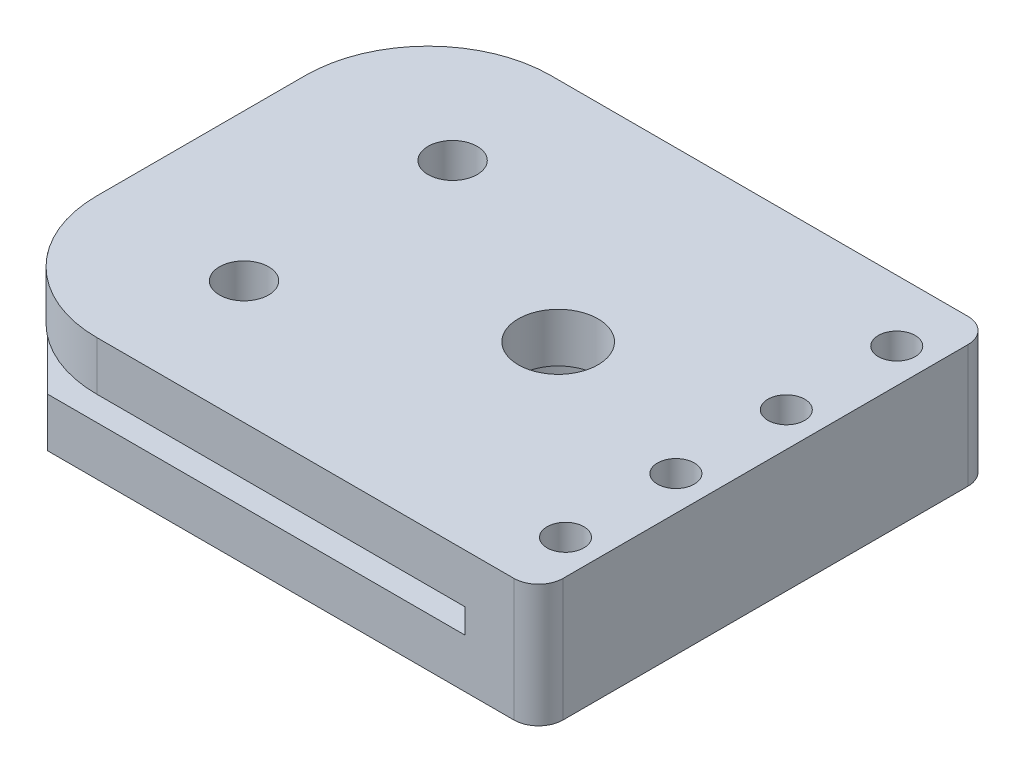
from build123d import *

# Parameters (mm, degrees)
SKETCH1_W           = 50
SKETCH1_H           = 37
BOSS_EXTRUDE1_DEPTH = 4
CHAMFER1_SIZE       = 10
SKETCH2_W           = 6
SKETCH2_H           = 37
BOSS_EXTRUDE2_DEPTH = 6
SKETCH3_W           = 37
SKETCH3_H           = 4
BOSS_EXTRUDE3_DEPTH = 40
FILLET1_R           = 10
SKETCH4_R           = 2
CUT_EXTRUDE1_DEPTH  = 40
SKETCH5_R           = 3.25
CUT_EXTRUDE2_DEPTH  = 40
SKETCH6_R           = 7.5
CUT_EXTRUDE3_DEPTH  = 5
SKETCH7_R           = 1.5
CUT_EXTRUDE4_DEPTH  = 9
FILLET2_R           = 2


with BuildPart() as part:
    # Sketch1 → Boss-Extrude1 (new body)
    with BuildSketch(Plane(origin=(0, 0, 0), x_dir=(1, 0, 0), z_dir=(0, 1, 0))):
        Rectangle(SKETCH1_W, SKETCH1_H)
    extrude(amount=BOSS_EXTRUDE1_DEPTH)

    # Chamfer1
    chamfer1_edges = [part.edges().sort_by_distance(p)[0] for p in [
        (-25, 2, 18.5),
        (-25, 2, -18.5),
    ]]
    chamfer(chamfer1_edges, length=CHAMFER1_SIZE)

    # Sketch2 → Boss-Extrude2 (add)
    with BuildSketch(Plane(origin=(0, 4, 0), x_dir=(1, 0, 0), z_dir=(0, 1, 0))):
        with Locations((22, 0)):
            Rectangle(SKETCH2_W, SKETCH2_H)
    extrude(amount=BOSS_EXTRUDE2_DEPTH)

    # Sketch3 → Boss-Extrude3 (add)
    with BuildSketch(Plane.ZY.offset(-19)):
        with Locations((0, 8)):
            Rectangle(SKETCH3_W, SKETCH3_H)
    extrude(amount=BOSS_EXTRUDE3_DEPTH)

    # Fillet1
    fillet1_edges = [part.edges().sort_by_distance(p)[0] for p in [
        (-21, 8, -18.5),
        (-21, 8, 18.5),
    ]]
    fillet(fillet1_edges, radius=FILLET1_R)

    # Sketch4 → Cut-Extrude1 (cut)
    with BuildSketch(Plane(origin=(0, 10, 0), x_dir=(1, 0, 0), z_dir=(0, 1, 0))):
        with Locations(Location((-9, -8.5, 0), (0, 0, 270))):
            Circle(SKETCH4_R)
        with Locations(Location((-9, 8.5, 0), (0, 0, 270))):
            Circle(SKETCH4_R)
    extrude(amount=-CUT_EXTRUDE1_DEPTH, mode=Mode.SUBTRACT)

    # Sketch5 → Cut-Extrude2 (cut)
    with BuildSketch(Plane(origin=(0, 10, 0), x_dir=(1, 0, 0), z_dir=(0, 1, 0))):
        with Locations(Location((8.102581703, 0, 0), (0, 0, 270))):
            Circle(SKETCH5_R)
    extrude(amount=-CUT_EXTRUDE2_DEPTH, mode=Mode.SUBTRACT)

    # Sketch6 → Cut-Extrude3 (cut)
    with BuildSketch(Plane.XZ):
        with Locations(Location((8.102581703, 0, 0), (0, 0, 270))):
            Circle(SKETCH6_R)
    extrude(amount=-CUT_EXTRUDE3_DEPTH, mode=Mode.SUBTRACT)

    # Sketch7 → Cut-Extrude4 (cut)
    with BuildSketch(Plane(origin=(0, 10, 0), x_dir=(1, 0, 0), z_dir=(0, 1, 0))):
        with Locations(Location((22.2, 13.5, 0), (0, 0, 270))):
            Circle(SKETCH7_R)
        with Locations(Location((22.2, 4.5, 0), (0, 0, 270))):
            Circle(SKETCH7_R)
        with Locations(Location((22.2, -4.5, 0), (0, 0, 270))):
            Circle(SKETCH7_R)
        with Locations(Location((22.2, -13.5, 0), (0, 0, 270))):
            Circle(SKETCH7_R)
    extrude(amount=-CUT_EXTRUDE4_DEPTH, mode=Mode.SUBTRACT)

    # Fillet2
    fillet2_edges = [part.edges().sort_by_distance(p)[0] for p in [
        (25, 5, 18.5),
        (25, 5, -18.5),
    ]]
    fillet(fillet2_edges, radius=FILLET2_R)


solid = part.part
